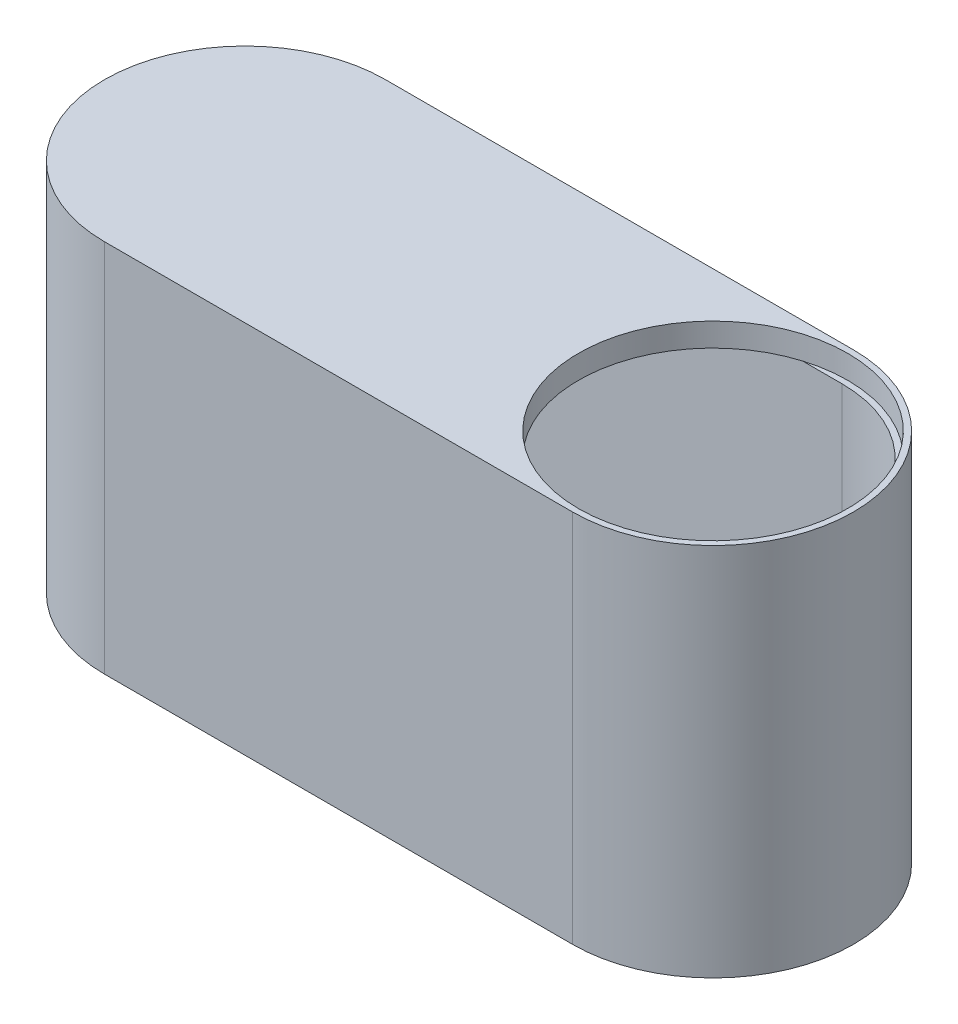
from build123d import *

# Parameters (mm, degrees)
BOSS_EXTRUDE1_DEPTH = 30
SKETCH3_R           = 11.5
BOSS_EXTRUDE2_DEPTH = 2


with BuildPart() as part:
    # Sketch2 → Boss-Extrude1 (new body)
    with BuildSketch(Plane(origin=(0, 0, 0), x_dir=(1, 0, 0), z_dir=(0, 1, 0))):
        with BuildLine():
            Line((77.29844251, 41.68564095), (117.29844251, 41.68564095))
            ThreePointArc((117.29844251, 41.68564095), (129.29844251, 53.68564095), (117.29844251, 65.68564095))
            Line((117.29844251, 65.68564095), (77.29844251, 65.68564095))
            ThreePointArc((77.29844251, 65.68564095), (65.29844251, 53.68564095), (77.29844251, 41.68564095))
        make_face()
        with BuildLine():
            Line((77.29844251, 64.68564095), (117.29844251, 64.68564095))
            ThreePointArc((117.29844251, 64.68564095), (128.29844251, 53.68564095), (117.29844251, 42.68564095))
            Line((117.29844251, 42.68564095), (77.29844251, 42.68564095))
            ThreePointArc((77.29844251, 42.68564095), (66.29844251, 53.68564095), (77.29844251, 64.68564095))
        make_face(mode=Mode.SUBTRACT)
    extrude(amount=BOSS_EXTRUDE1_DEPTH)

    # Sketch3 → Boss-Extrude2 (add)
    with BuildSketch(Plane(origin=(0, 30, 0), x_dir=(1, 0, 0), z_dir=(0, 1, 0))):
        with BuildLine():
            Line((77.29844251, 65.68564095), (117.29844251, 65.68564095))
            ThreePointArc((117.29844251, 65.68564095), (129.29844251, 53.68564095), (117.29844251, 41.68564095))
            Line((117.29844251, 41.68564095), (77.29844251, 41.68564095))
            ThreePointArc((77.29844251, 41.68564095), (65.29844251, 53.68564095), (77.29844251, 65.68564095))
        make_face()
        with Locations(Location((117.29844251, 53.68564095, 0), (0, 0, 106.957426294))):
            Circle(SKETCH3_R, mode=Mode.SUBTRACT)
    extrude(amount=BOSS_EXTRUDE2_DEPTH)


solid = part.part
